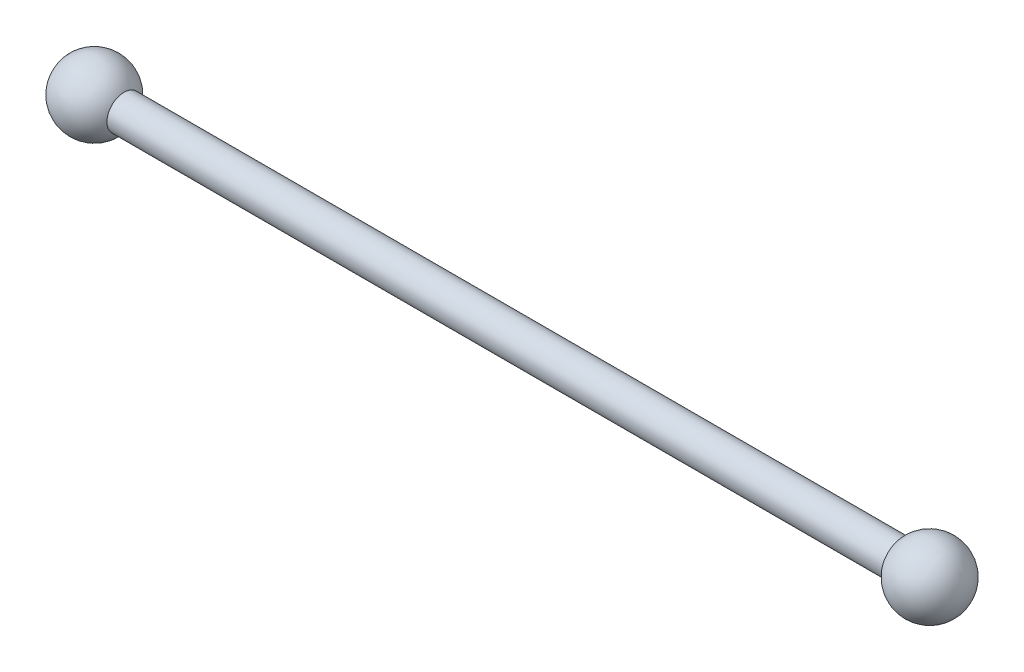
from build123d import *

# Parameters (mm, degrees)
SKETCH1_W = 34.5
SKETCH1_H = 1.5


with BuildPart() as part:
    # Sketch1 → Revolve1 (revolve)
    with BuildSketch(Plane.XY):
        Rectangle(SKETCH1_W, SKETCH1_H)
        with BuildLine():
            ThreePointArc((22.25, -0.75), (20.026457135, 2.147777479), (16.651923789, 0.75))
            Line((16.651923789, 0.75), (17.25, 0.75))
            Line((17.25, 0.75), (17.25, -0.75))
            Line((17.25, -0.75), (22.25, -0.75))
        make_face()
    revolve1 = revolve(axis=Axis((-17.25, -0.75, 0), (1, 0, 0)))

    # Mirror1: Revolve1 across plane
    add(revolve1.mirror(Plane(origin=(-17.25, 0, 0), x_dir=(0, 0, 1), z_dir=(1, 0, 0))))


solid = part.part
